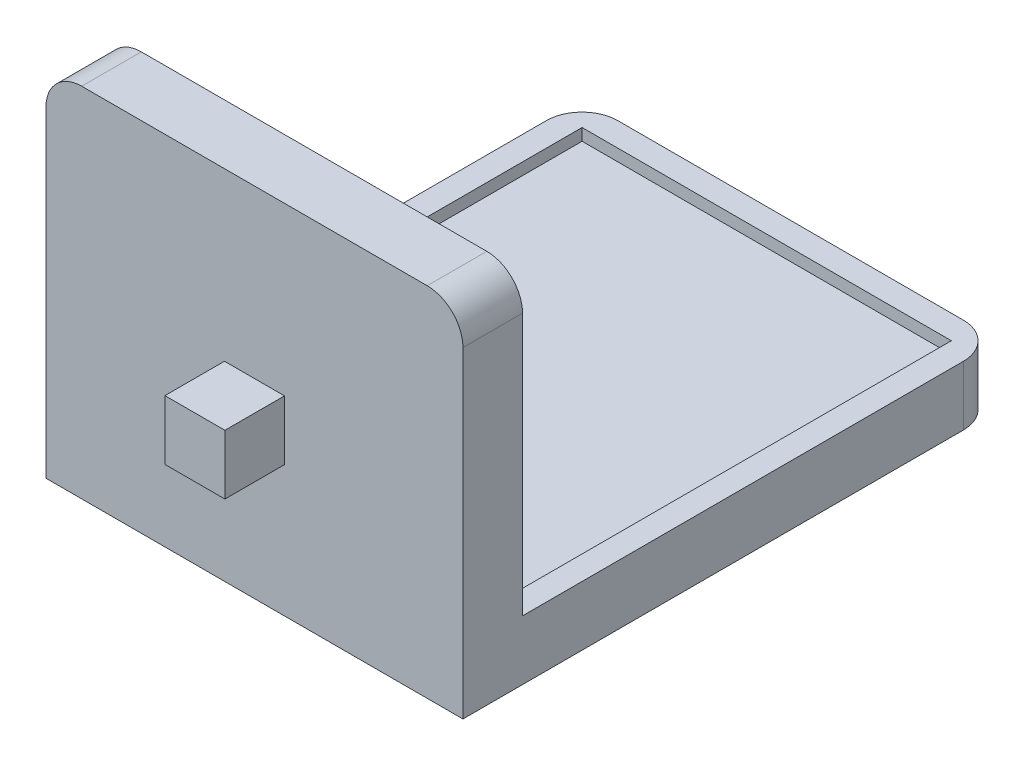
from build123d import *

# Parameters (mm, degrees)
SKETCH1_W           = 35
SKETCH1_H           = 40
BOSS_EXTRUDE1_DEPTH = 5
SKETCH2_W           = 31
SKETCH2_H           = 36
CUT_EXTRUDE1_DEPTH  = 1
SKETCH3_W           = 35
SKETCH3_H           = 30
BOSS_EXTRUDE2_DEPTH = 5
FILLET2_R           = 3
FILLET3_R           = 3
FILLET4_R           = 3
SKETCH4_W           = 5.036167186
SKETCH4_H           = 5
BOSS_EXTRUDE3_DEPTH = 5


with BuildPart() as part:
    # Sketch1 → Boss-Extrude1 (new body)
    with BuildSketch(Plane(origin=(0, 0, 0), x_dir=(1, 0, 0), z_dir=(0, 1, 0))):
        with Locations((17.5, 20)):
            Rectangle(SKETCH1_W, SKETCH1_H)
    extrude(amount=BOSS_EXTRUDE1_DEPTH)

    # Sketch2 → Cut-Extrude1 (cut)
    with BuildSketch(Plane(origin=(0, 5, 0), x_dir=(1, 0, 0), z_dir=(0, 1, 0))):
        with Locations((17.5, 20)):
            Rectangle(SKETCH2_W, SKETCH2_H)
    extrude(amount=-CUT_EXTRUDE1_DEPTH, mode=Mode.SUBTRACT)

    # Sketch3 → Boss-Extrude2 (add)
    with BuildSketch(Plane.XY):
        with Locations((17.5, 15)):
            Rectangle(SKETCH3_W, SKETCH3_H)
    extrude(amount=BOSS_EXTRUDE2_DEPTH)

    # Fillet2
    fillet2_edges = [part.edges().sort_by_distance(p)[0] for p in [
        (0, 2.5, -40),
    ]]
    fillet(fillet2_edges, radius=FILLET2_R)

    # Fillet3
    fillet3_edges = [part.edges().sort_by_distance(p)[0] for p in [
        (35, 2.5, -40),
    ]]
    fillet(fillet3_edges, radius=FILLET3_R)

    # Fillet4
    fillet4_edges = [part.edges().sort_by_distance(p)[0] for p in [
        (0, 30, 2.5),
        (35, 30, 2.5),
    ]]
    fillet(fillet4_edges, radius=FILLET4_R)

    # Sketch4 → Boss-Extrude3 (add)
    with BuildSketch(Plane.XY.offset(5)):
        with Locations((17.5, 13.5)):
            Rectangle(SKETCH4_W, SKETCH4_H)
    extrude(amount=BOSS_EXTRUDE3_DEPTH)


solid = part.part
